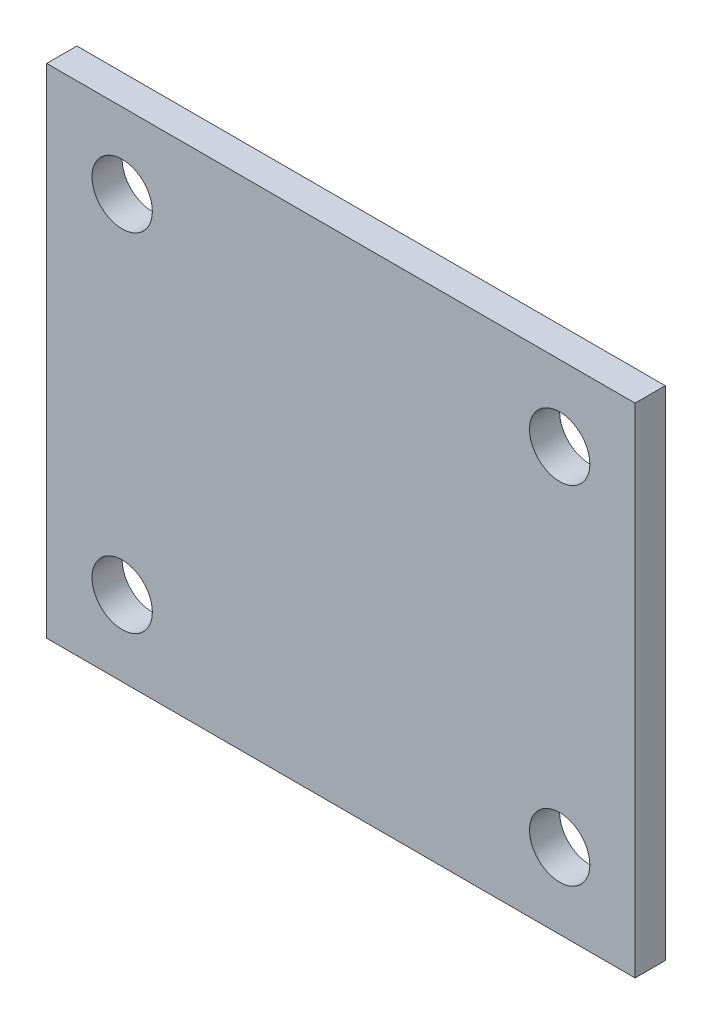
from build123d import *

# Parameters (mm, degrees)
SKETCH_1_W      = 39
SKETCH_1_H      = 33
SKETCH_1_R      = 2
EXTRUDE_1_DEPTH = 2


with BuildPart() as part:
    # 草圖1 → 填料-伸長1 (new body)
    with BuildSketch(Plane.XY):
        Rectangle(SKETCH_1_W, SKETCH_1_H)
        with Locations((-14.5, 11.5)):
            Circle(SKETCH_1_R, mode=Mode.SUBTRACT)
        with Locations((-14.5, -11.5)):
            Circle(SKETCH_1_R, mode=Mode.SUBTRACT)
        with Locations((14.5, -11.5)):
            Circle(SKETCH_1_R, mode=Mode.SUBTRACT)
        with Locations((14.5, 11.5)):
            Circle(SKETCH_1_R, mode=Mode.SUBTRACT)
    extrude(amount=EXTRUDE_1_DEPTH)


solid = part.part
